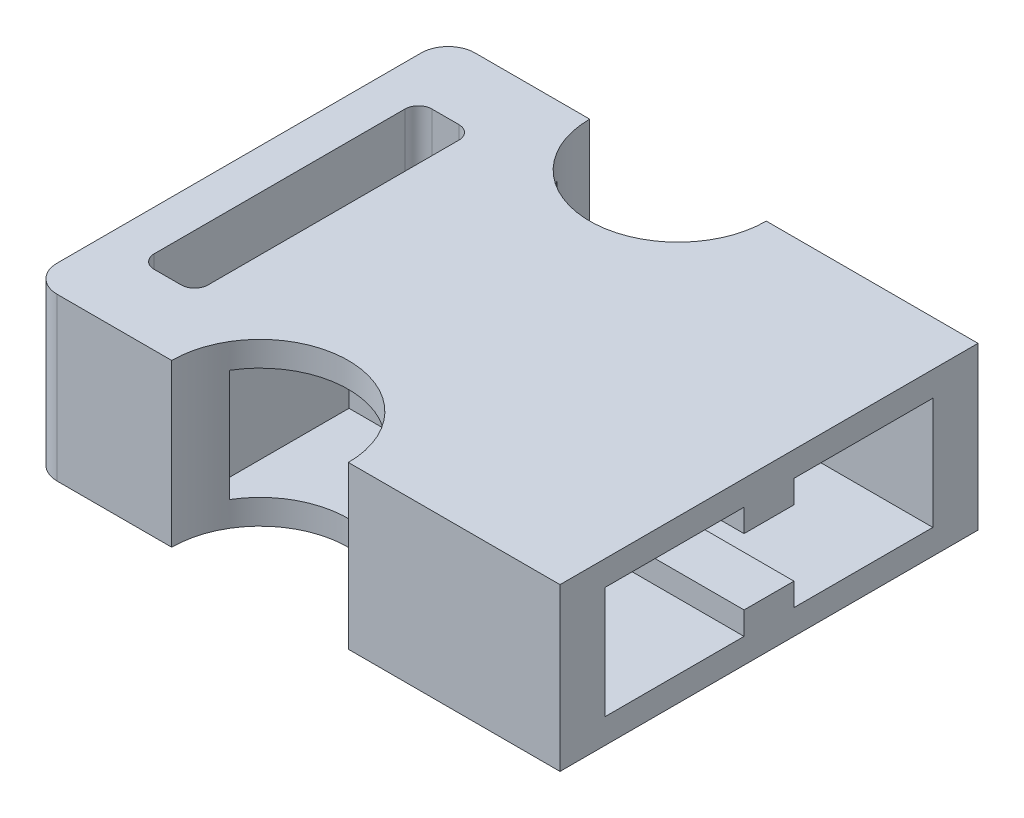
from build123d import *

# Parameters (mm, degrees)
BOSS_EXTRUDE1_DEPTH = 15.24
BOSS_EXTRUDE2_DEPTH = 15.24
SKETCH6_W           = 37.211
SKETCH6_H           = 30.861
CUT_EXTRUDE1_DEPTH  = 5.2705
SKETCH7_W           = 37.211
SKETCH7_H           = 4.699
BOSS_EXTRUDE3_DEPTH = 2.159


with BuildPart() as part:
    # Sketch3 → Boss-Extrude1 (new body)
    with BuildSketch(Plane(origin=(0, 0, 0), x_dir=(1, 0, 0), z_dir=(0, 1, 0))):
        with BuildLine():
            Line((2.54, 0), (10.16, 0))
            Line((10.16, 0), (12.7, 0))
            Line((12.7, 0), (12.7, 2.54))
            Line((12.7, 2.54), (12.7, 36.83))
            Line((12.7, 36.83), (12.7, 39.37))
            Line((12.7, 39.37), (10.16, 39.37))
            Line((10.16, 39.37), (2.54, 39.37))
            ThreePointArc((2.54, 39.37), (0.743948776, 38.626051224), (0, 36.83))
            Line((0, 36.83), (0, 2.54))
            ThreePointArc((0, 2.54), (0.743948776, 0.743948776), (2.54, 0))
        make_face()
        with BuildLine():
            Line((5.08, 6.604), (7.62, 6.604))
            ThreePointArc((7.62, 6.604), (8.518025612, 6.975974388), (8.89, 7.874))
            Line((8.89, 7.874), (8.89, 31.496))
            ThreePointArc((8.89, 31.496), (8.518025612, 32.394025612), (7.62, 32.766))
            Line((7.62, 32.766), (5.08, 32.766))
            ThreePointArc((5.08, 32.766), (4.181974388, 32.394025612), (3.81, 31.496))
            Line((3.81, 31.496), (3.81, 7.874))
            ThreePointArc((3.81, 7.874), (4.181974388, 6.975974388), (5.08, 6.604))
        make_face(mode=Mode.SUBTRACT)
    extrude(amount=BOSS_EXTRUDE1_DEPTH)

    # Sketch4 → Boss-Extrude2 (add)
    with BuildSketch(Plane(origin=(0, 0, 0), x_dir=(1, 0, 0), z_dir=(0, 1, 0))):
        with BuildLine():
            Line((12.7, 39.37), (13.335, 39.37))
            ThreePointArc((13.335, 39.37), (21.6535, 31.0515), (29.972, 39.37))
            Line((29.972, 39.37), (49.911, 39.37))
            Line((49.911, 39.37), (49.911, 0))
            Line((49.911, 0), (29.972, 0))
            ThreePointArc((29.972, 0), (21.6535, 8.3185), (13.335, 0))
            Line((13.335, 0), (12.7, 0))
            Line((12.7, 0), (12.7, 39.37))
        make_face()
    extrude(amount=BOSS_EXTRUDE2_DEPTH)

    # Sketch6 → Cut-Extrude1 (cut, symmetric)
    with BuildSketch(Plane(origin=(0, 7.62, 0), x_dir=(1, 0, 0), z_dir=(0, 1, 0))):
        with Locations((31.3055, 19.685)):
            Rectangle(SKETCH6_W, SKETCH6_H)
    extrude(amount=CUT_EXTRUDE1_DEPTH, both=True, mode=Mode.SUBTRACT)

    # Sketch7 → Boss-Extrude3 (add)
    with BuildSketch(Plane(origin=(0, 2.3495, 0), x_dir=(1, 0, 0), z_dir=(0, 1, 0))):
        with Locations((31.3055, 19.685)):
            Rectangle(SKETCH7_W, SKETCH7_H)
    boss_extrude3 = extrude(amount=BOSS_EXTRUDE3_DEPTH)

    # Mirror1: Boss-Extrude3 across plane
    add(boss_extrude3.mirror(Plane.ZX.offset(7.62)))


solid = part.part
